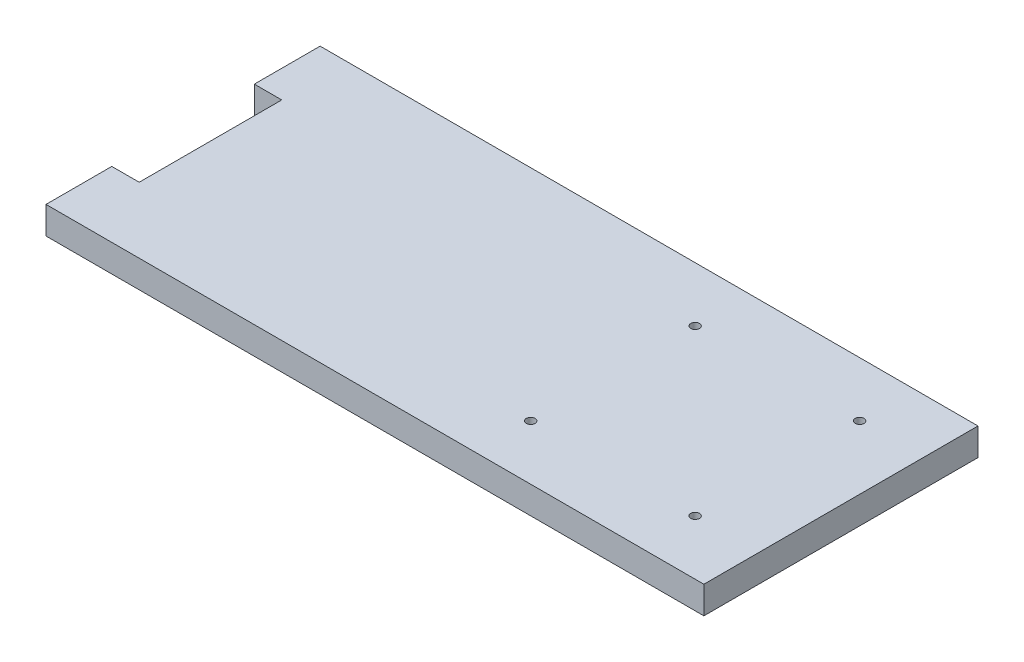
from build123d import *

# Parameters (mm, degrees)
SKETCH1_W           = 76.2
SKETCH1_H           = 31.75
BOSS_EXTRUDE1_DEPTH = 3.175
SKETCH2_R           = 0.508
SKETCH2_W           = 3.175
SKETCH2_H           = 16.51
CUT_EXTRUDE1_DEPTH  = 3.175


with BuildPart() as part:
    # Sketch1 → Boss-Extrude1 (new body)
    with BuildSketch(Plane(origin=(0, 0, 0), x_dir=(1, 0, 0), z_dir=(0, 1, 0))):
        Rectangle(SKETCH1_W, SKETCH1_H)
    extrude(amount=BOSS_EXTRUDE1_DEPTH)

    # Sketch2 → Cut-Extrude1 (cut)
    with BuildSketch(Plane(origin=(0, 3.175, 0), x_dir=(1, 0, 0), z_dir=(0, 1, 0))):
        with Locations(Location((30.737005641, 9.525, 0), (0, 0, 270))):
            Circle(SKETCH2_R)
        with Locations(Location((30.737005641, -9.525, 0), (0, 0, 270))):
            Circle(SKETCH2_R)
        with Locations(Location((11.687005641, 9.525, 0), (0, 0, 270))):
            Circle(SKETCH2_R)
        with Locations(Location((11.687005641, -9.525, 0), (0, 0, 270))):
            Circle(SKETCH2_R)
        with Locations((-36.5125, 0)):
            Rectangle(SKETCH2_W, SKETCH2_H)
    extrude(amount=-CUT_EXTRUDE1_DEPTH, mode=Mode.SUBTRACT)


solid = part.part
